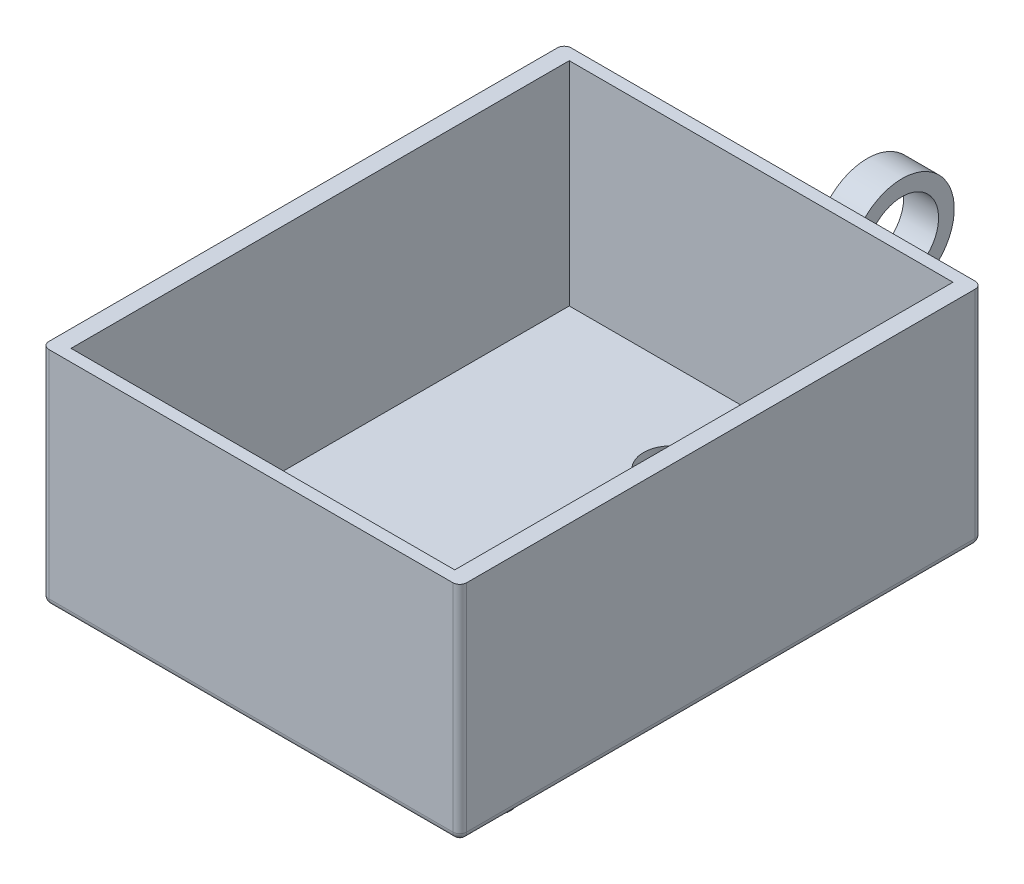
from build123d import *

# Parameters (mm, degrees)
SKETCH1_W           = 60
SKETCH1_H           = 32
BOSS_EXTRUDE1_DEPTH = 75
SKETCH2_W           = 55.096049088
SKETCH2_H           = 71.542939766
CUT_EXTRUDE1_DEPTH  = 30.5
SKETCH3_W           = 2.5
SKETCH3_H           = 5
BOSS_EXTRUDE2_DEPTH = 10
SKETCH4_R           = 5.25
BOSS_EXTRUDE3_DEPTH = 5
SKETCH8_W           = 50
SKETCH8_H           = 20
BOSS_EXTRUDE5_DEPTH = 0.1
CUT_EXTRUDE2_DEPTH  = 20
SKETCH10_W          = 5
SKETCH10_H          = 8
CUT_EXTRUDE3_DEPTH  = 20
FILLET2_R           = 2
FILLET4_R           = 1
SKETCH11_W          = 6
SKETCH11_H          = 6
CUT_EXTRUDE4_DEPTH  = 10
BOSS_EXTRUDE6_DEPTH = 2


with BuildPart() as part:
    # Sketch1 → Boss-Extrude1 (new body)
    with BuildSketch(Plane.XY):
        with Locations((30, 16)):
            Rectangle(SKETCH1_W, SKETCH1_H)
    extrude(amount=BOSS_EXTRUDE1_DEPTH)

    # Sketch2 → Cut-Extrude1 (cut)
    with BuildSketch(Plane(origin=(0, 32, 0), x_dir=(1, 0, 0), z_dir=(0, 1, 0))):
        with Locations((30, -37.5)):
            Rectangle(SKETCH2_W, SKETCH2_H)
    extrude(amount=-CUT_EXTRUDE1_DEPTH, mode=Mode.SUBTRACT)

    # Sketch3 → Boss-Extrude2 (add)
    with BuildSketch(Plane(origin=(0, 0, 0), x_dir=(-1, 0, 0), z_dir=(0, 0, -1))):
        with Locations((-28.75, 16)):
            Rectangle(SKETCH3_W, SKETCH3_H)
        with Locations((-31.25, 16)):
            Rectangle(SKETCH3_W, SKETCH3_H)
    extrude(amount=BOSS_EXTRUDE2_DEPTH)

    # Sketch8 → Boss-Extrude5 (add)
    with BuildSketch(Plane(origin=(0, 0, 73.271469883), x_dir=(-1, 0, 0), z_dir=(0, 0, -1))):
        with Locations((-30, 16.5)):
            Rectangle(SKETCH8_W, SKETCH8_H)
    extrude(amount=BOSS_EXTRUDE5_DEPTH)

    # Sketch9 → Cut-Extrude2 (cut)
    with BuildSketch(Plane(origin=(0, 1.5, 0), x_dir=(1, 0, 0), z_dir=(0, 1, 0))):
        with BuildLine():
            ThreePointArc((30, -37.635734942), (27.25, -40.385734942), (30, -43.135734942))
            Line((30, -43.135734942), (30, -37.635734942))
        make_face()
        with BuildLine():
            Line((30, -37.635734942), (30, -43.135734942))
            ThreePointArc((30, -43.135734942), (31.944543648, -42.33027859), (32.75, -40.385734942))
            ThreePointArc((32.75, -40.385734942), (31.944543648, -38.441191293), (30, -37.635734942))
        make_face()
        with BuildLine():
            ThreePointArc((30, -10.614265058), (26, -14.614265058), (30, -18.614265058))
            Line((30, -18.614265058), (30, -10.614265058))
        make_face()
        with BuildLine():
            Line((30, -10.614265058), (30, -18.614265058))
            ThreePointArc((30, -18.614265058), (32.828427125, -17.442692183), (34, -14.614265058))
            ThreePointArc((34, -14.614265058), (32.828427125, -11.785837934), (30, -10.614265058))
        make_face()
    extrude(amount=-CUT_EXTRUDE2_DEPTH, mode=Mode.SUBTRACT)

    # Sketch10 → Cut-Extrude3 (cut)
    with BuildSketch(Plane(origin=(2.451975456, 0, 0), x_dir=(0, 0, -1), z_dir=(1, 0, 0))):
        with Locations((-68.771469883, 16.5)):
            Rectangle(SKETCH10_W, SKETCH10_H)
    extrude(amount=-CUT_EXTRUDE3_DEPTH, mode=Mode.SUBTRACT)

    # Fillet2
    fillet2_edges = [part.edges().sort_by_distance(p)[0] for p in [
        (32.5, 13.5, -5),
        (27.5, 13.5, -5),
        (27.5, 18.5, -5),
        (32.5, 18.5, -5),
    ]]
    fillet(fillet2_edges, radius=FILLET2_R)

    # Fillet4
    fillet4_edges = [part.edges().sort_by_distance(p)[0] for p in [
        (60, 16, 75),
        (0, 16, 75),
        (60, 16, 0),
        (30, 0, 0),
        (0, 16, 0),
        (60, 0, 37.5),
        (0, 0, 37.5),
        (30, 0, 75),
    ]]
    fillet(fillet4_edges, radius=FILLET4_R)

    # Sketch11 → Cut-Extrude4 (cut)
    with BuildSketch(Plane(origin=(0, 0, 0), x_dir=(-1, 0, 0), z_dir=(0, 0, -1))):
        with Locations((-49.289598549, 16)):
            Rectangle(SKETCH11_W, SKETCH11_H)
    extrude(amount=-CUT_EXTRUDE4_DEPTH, mode=Mode.SUBTRACT)

    # Sketch12 → Boss-Extrude6 (add)
    # profile 1 of 3: a face of its own
    with BuildSketch(Plane(origin=(0, 0, 0), x_dir=(-1, 0, 0), z_dir=(0, -1, 0))):
        Polygon((-57.5, -65.717948718), (-57.5, -64.820512821), (-48.525641026, -64.820512821), (-48.525641026, -60.974358974), (-47.5, -60.974358974), (-47.5, -65.717948718), align=None)
    # profile 2 of 3: a face of its own
    with BuildSketch(Plane(origin=(0, 0, 0), x_dir=(-1, 0, 0), z_dir=(0, -1, 0))):
        Polygon((-40, -65.717948718), (-40, -60.076923077), (-38.974358974, -60.076923077), (-38.974358974, -64.820512821), (-35.897435897, -64.820512821), (-35.897435897, -60.076923077), (-34.871794872, -60.076923077), (-34.871794872, -64.820512821), (-31.025641026, -64.820512821), (-31.025641026, -60.076923077), (-30, -60.076923077), (-30, -65.717948718), align=None)
    # profile 3 of 3: a face of its own
    with BuildSketch(Plane(origin=(0, 0, 0), x_dir=(-1, 0, 0), z_dir=(0, -1, 0))):
        with BuildLine():
            Line((-12.5, -65.717948718), (-22.5, -65.717948718))
            Line((-22.5, -65.717948718), (-22.5, -63.698717949))
            add(Edge.make_bspline(
                [(-22.5, -63.698717949), (-22.498735514, -63.523092268), (-22.496292535, -63.183784367), (-22.480802846, -62.693463089), (-22.453401515, -62.239795196), (-22.413488583, -61.824272742), (-22.364479915, -61.445754993), (-22.303050189, -61.105301827), (-22.230512559, -60.801152847), (-22.168668415, -60.614097303), (-22.139423077, -60.525641026)],
                knots=[0, 0, 0, 0, 1.314313732, 2.53924729, 3.670748893, 4.714932338, 5.66265055, 6.526160246, 7.303039223, 8, 8, 8, 8], degree=3))
            add(Edge.make_bspline(
                [(-22.139423077, -60.525641026), (-22.095349076, -60.40993135), (-22.008200527, -60.181135911), (-21.843554638, -59.855552544), (-21.657769926, -59.548007707), (-21.446570967, -59.260953421), (-21.212715665, -58.993669435), (-20.957874681, -58.743122156), (-20.67638683, -58.515488829), (-20.373262431, -58.307224063), (-20.052385359, -58.119395673), (-19.71428113, -57.956144238), (-19.360690172, -57.820560503), (-18.992589457, -57.708008673), (-18.609171316, -57.61930444), (-18.209988819, -57.558784654), (-17.796619712, -57.518867535), (-17.516121244, -57.514855961), (-17.373798077, -57.512820513)],
                knots=[0, 0, 0, 0, 0.984741985, 1.947153288, 2.898543998, 3.841229145, 4.778974371, 5.722123648, 6.681464302, 7.655713756, 8.646344578, 9.637374342, 10.639946623, 11.656849581, 12.698333139, 13.76849723, 14.867749466, 16, 16, 16, 16], degree=3))
            add(Edge.make_bspline(
                [(-17.373798077, -57.512820513), (-17.25019454, -57.514617564), (-17.006620859, -57.518158841), (-16.647646855, -57.549956867), (-16.299322425, -57.596174997), (-15.963305925, -57.667729584), (-15.636654651, -57.754594866), (-15.32284539, -57.8659175), (-15.019016377, -57.993460367), (-14.729213759, -58.142126946), (-14.454829341, -58.305560099), (-14.195979143, -58.479856653), (-13.958407138, -58.66896952), (-13.735887862, -58.867301532), (-13.534365667, -59.079635436), (-13.350167074, -59.3033861), (-13.186375966, -59.539423077), (-13.040418525, -59.789207505), (-12.909892823, -60.056075317), (-12.801018728, -60.348420856), (-12.706722647, -60.664859341), (-12.631710109, -61.00719534), (-12.57121196, -61.374207846), (-12.530932059, -61.766914959), (-12.503614678, -62.184574518), (-12.501228288, -62.47137341), (-12.5, -62.618990385)],
                knots=[0, 0, 0, 0, 1.106010661, 2.179509527, 3.223302912, 4.248870533, 5.252098245, 6.246278179, 7.226402005, 8.199283979, 9.158616973, 10.083547221, 10.989831858, 11.874256832, 12.749262829, 13.607058236, 14.46581075, 15.317568432, 16.194266721, 17.121067875, 18.106207572, 19.147242834, 20.255495536, 21.43354536, 22.679031616, 24, 24, 24, 24], degree=3))
            Line((-12.5, -62.618990385), (-12.5, -65.717948718))
        make_face()
        with BuildLine():
            Line((-13.525641026, -64.820512821), (-13.525641026, -63.672676282))
            add(Edge.make_bspline(
                [(-13.525641026, -63.672676282), (-13.526349872, -63.50773808), (-13.527713244, -63.190501513), (-13.539676682, -62.734335807), (-13.559225075, -62.317537531), (-13.58658244, -61.940047504), (-13.622778483, -61.602078863), (-13.663135348, -61.302925292), (-13.713413779, -61.043567411), (-13.758987949, -60.886626163), (-13.780048077, -60.814102564)],
                knots=[0, 0, 0, 0, 1.375205317, 2.645023457, 3.804390687, 4.853969522, 5.800190428, 6.637939096, 7.370582563, 8, 8, 8, 8], degree=3))
            add(Edge.make_bspline(
                [(-13.780048077, -60.814102564), (-13.81219538, -60.72282152), (-13.875722149, -60.542439678), (-13.991601268, -60.282779572), (-14.128864005, -60.040616196), (-14.281443099, -59.811732258), (-14.454713028, -59.599363483), (-14.644932236, -59.401034788), (-14.852969787, -59.216988985), (-15.078488342, -59.050060878), (-15.319042421, -58.898862431), (-15.575057466, -58.769064907), (-15.842934289, -58.656028267), (-16.124841506, -58.566523719), (-16.418712888, -58.495953304), (-16.726072283, -58.446487389), (-17.046647714, -58.415778201), (-17.264887143, -58.412117076), (-17.375801282, -58.41025641)],
                knots=[0, 0, 0, 0, 0.998590647, 1.973329978, 2.929871262, 3.868367705, 4.809062953, 5.754642869, 6.701828697, 7.672172887, 8.647399344, 9.630604387, 10.631475358, 11.644913558, 12.679592956, 13.747988925, 14.855477812, 16, 16, 16, 16], degree=3))
            add(Edge.make_bspline(
                [(-17.375801282, -58.41025641), (-17.492754083, -58.411722946), (-17.722508895, -58.414603967), (-18.059625168, -58.450816283), (-18.383855598, -58.503735013), (-18.69522187, -58.58025983), (-18.994331448, -58.677776627), (-19.279530048, -58.799475603), (-19.553829674, -58.938523087), (-19.81089929, -59.103961192), (-20.054022459, -59.285148602), (-20.276750789, -59.486228257), (-20.479591647, -59.70400551), (-20.665703969, -59.93610508), (-20.827600186, -60.18906822), (-20.972419275, -60.456935908), (-21.095321821, -60.743637826), (-21.160690001, -60.943102671), (-21.193910256, -61.044471154)],
                knots=[0, 0, 0, 0, 1.122418816, 2.205001699, 3.251619955, 4.274784885, 5.280384055, 6.268708349, 7.249350384, 8.229342522, 9.199999885, 10.157847722, 11.105861043, 12.055065948, 13.010012805, 13.98527497, 14.976112212, 16, 16, 16, 16], degree=3))
            add(Edge.make_bspline(
                [(-21.193910256, -61.044471154), (-21.21710005, -61.128331572), (-21.266407915, -61.30664183), (-21.320194693, -61.597611727), (-21.367636119, -61.925083583), (-21.407801946, -62.2905113), (-21.436622864, -62.693478326), (-21.458255191, -63.134294578), (-21.47284557, -63.613150591), (-21.473841876, -63.945100687), (-21.474358974, -64.117387821)],
                knots=[0, 0, 0, 0, 0.674548936, 1.434276114, 2.292660221, 3.240891867, 4.284742987, 5.42552168, 6.663806718, 8, 8, 8, 8], degree=3))
            Line((-21.474358974, -64.117387821), (-21.474358974, -64.820512821))
            Line((-21.474358974, -64.820512821), (-13.525641026, -64.820512821))
        make_face(mode=Mode.SUBTRACT)
    extrude(amount=BOSS_EXTRUDE6_DEPTH)


with BuildPart() as body_2:
    # Sketch4 → Boss-Extrude3 (new body)
    with BuildSketch(Plane.ZY.offset(-27.5)):
        with BuildLine():
            Line((-10, 13.5), (-10, 16))
            Line((-10, 16), (-10, 18.5))
            Line((-10, 18.5), (-8.928932188, 18.5))
            ThreePointArc((-8.928932188, 18.5), (-23.5, 16), (-8.928932188, 13.5))
            Line((-8.928932188, 13.5), (-10, 13.5))
        make_face()
        with Locations((-16, 16)):
            Circle(SKETCH4_R, mode=Mode.SUBTRACT)
    extrude(amount=-BOSS_EXTRUDE3_DEPTH)


solid = Compound([part.part, body_2.part])
